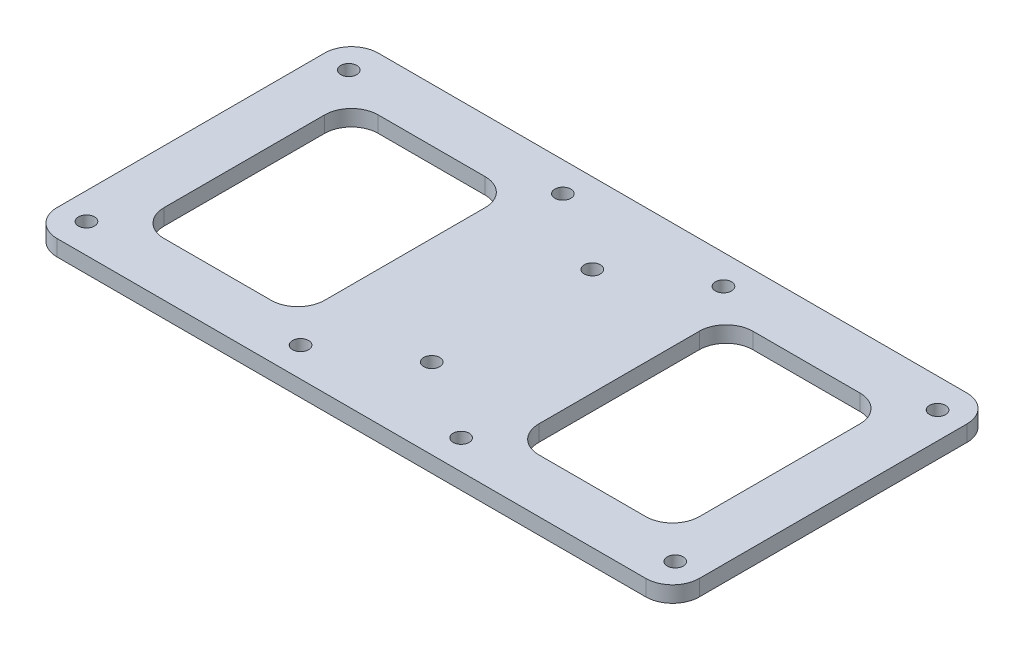
from build123d import *

# Parameters (mm, degrees)
SKETCH_1_W          = 120
SKETCH_1_H          = 60
EXTRUDE_1_DEPTH     = 3
SKETCH_2_R          = 1.5
CUT_EXTRUDE_1_DEPTH = 68.149087857
SKETCH_3_R          = 1.5
CUT_EXTRUDE_2_DEPTH = 68.149087857
FILLET_1_R          = 5
SKETCH_4_W          = 30
SKETCH_4_H          = 40
CUT_EXTRUDE_3_DEPTH = 68.149087857
FILLET_2_R          = 5


with BuildPart() as part:
    # 草图1 → 凸台-拉伸1 (new body)
    with BuildSketch(Plane(origin=(0, 0, 0), x_dir=(1, 0, 0), z_dir=(0, 1, 0))):
        Rectangle(SKETCH_1_W, SKETCH_1_H)
    extrude(amount=EXTRUDE_1_DEPTH)

    # 草图2 → 切除-拉伸1 (cut, through all)
    with BuildSketch(Plane(origin=(0, 3, 0), x_dir=(1, 0, 0), z_dir=(0, 1, 0))):
        with Locations((-55, 24.5)):
            Circle(SKETCH_2_R)
        with Locations((-15, 24.5)):
            Circle(SKETCH_2_R)
        with Locations((-55, -24.5)):
            Circle(SKETCH_2_R)
        with Locations((-15, -24.5)):
            Circle(SKETCH_2_R)
        with Locations((15, -24.5)):
            Circle(SKETCH_2_R)
        with Locations((55, -24.5)):
            Circle(SKETCH_2_R)
        with Locations((15, 24.5)):
            Circle(SKETCH_2_R)
        with Locations((55, 24.5)):
            Circle(SKETCH_2_R)
    extrude(amount=-CUT_EXTRUDE_1_DEPTH, mode=Mode.SUBTRACT)

    # 草图3 → 切除-拉伸2 (cut, through all)
    with BuildSketch(Plane(origin=(0, 3, 0), x_dir=(1, 0, 0), z_dir=(0, 1, 0))):
        with Locations((0, 15)):
            Circle(SKETCH_3_R)
        with Locations((0, -15)):
            Circle(SKETCH_3_R)
    extrude(amount=-CUT_EXTRUDE_2_DEPTH, mode=Mode.SUBTRACT)

    # 圆角1
    fillet_1_edges = [part.edges().sort_by_distance(p)[0] for p in [
        (-60, 1.5, 30),
        (60, 1.5, 30),
        (60, 1.5, -30),
        (-60, 1.5, -30),
    ]]
    fillet(fillet_1_edges, radius=FILLET_1_R)

    # 草图4 → 切除-拉伸3 (cut, through all)
    with BuildSketch(Plane(origin=(0, 3, 0), x_dir=(1, 0, 0), z_dir=(0, 1, 0))):
        with Locations((35, 0)):
            Rectangle(SKETCH_4_W, SKETCH_4_H)
        with Locations((-35, 0)):
            Rectangle(SKETCH_4_W, SKETCH_4_H)
    extrude(amount=-CUT_EXTRUDE_3_DEPTH, mode=Mode.SUBTRACT)

    # 圆角2
    fillet_2_edges = [part.edges().sort_by_distance(p)[0] for p in [
        (50, 1.5, 20),
        (50, 1.5, -20),
        (20, 1.5, -20),
        (20, 1.5, 20),
        (-50, 1.5, 20),
        (-20, 1.5, 20),
        (-20, 1.5, -20),
        (-50, 1.5, -20),
    ]]
    fillet(fillet_2_edges, radius=FILLET_2_R)


solid = part.part
